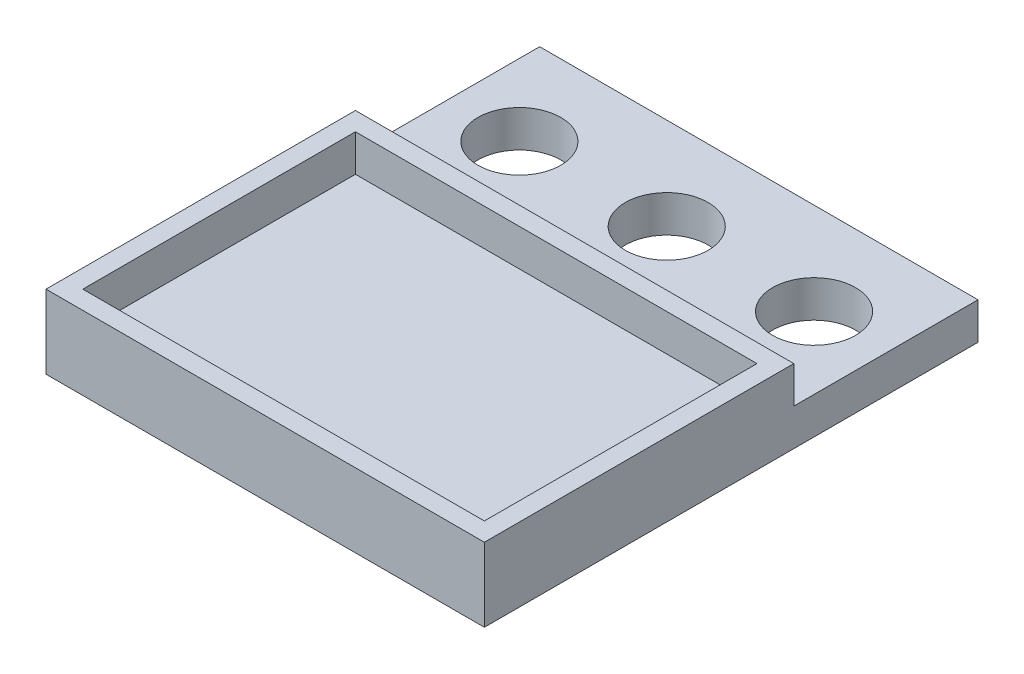
from build123d import *

# Parameters (mm, degrees)
SKETCH_1_W      = 23.8
SKETCH_1_H      = 10
SKETCH_1_R      = 2.25
SKETCH_1_H_2    = 16.8
SKETCH_1_W_2    = 21.8
SKETCH_1_H_3    = 14.8
EXTRUDE_1_DEPTH = 2
EXTRUDE_START   = 2
SKETCH_1_3_W    = 23.8
SKETCH_1_3_H    = 16.8
SKETCH_1_3_W_2  = 21.8
SKETCH_1_3_H_2  = 14.8
EXTRUDE_2_DEPTH = 2


with BuildPart() as part:
    # 草图1 → 凸台-拉伸1 (new body)
    # profile 1 of 3: a face of its own
    with BuildSketch(Plane(origin=(0, 0, 0), x_dir=(1, 0, 0), z_dir=(0, 1, 0))):
        with Locations((0, 13.4)):
            Rectangle(SKETCH_1_W, SKETCH_1_H)
        with Locations(Location((0, 13.4, 0), (0, 0, 270))):
            Circle(SKETCH_1_R, mode=Mode.SUBTRACT)
        with Locations(Location((-8, 13.4, 0), (0, 0, 270))):
            Circle(SKETCH_1_R, mode=Mode.SUBTRACT)
        with Locations(Location((8, 13.4, 0), (0, 0, 270))):
            Circle(SKETCH_1_R, mode=Mode.SUBTRACT)
    # profile 2 of 3: a face of its own
    with BuildSketch(Plane(origin=(0, 0, 0), x_dir=(1, 0, 0), z_dir=(0, 1, 0))):
        Rectangle(SKETCH_1_W, SKETCH_1_H_2)
        Rectangle(SKETCH_1_W_2, SKETCH_1_H_3, mode=Mode.SUBTRACT)
    # profile 3 of 3: a face of its own
    with BuildSketch(Plane(origin=(0, 0, 0), x_dir=(1, 0, 0), z_dir=(0, 1, 0))):
        Rectangle(SKETCH_1_W_2, SKETCH_1_H_3)
    extrude(amount=EXTRUDE_1_DEPTH)

    # 草图1<3> → 凸台-拉伸2 (add)
    with BuildSketch(Plane(origin=(0, 0, 0), x_dir=(1, 0, 0), z_dir=(0, 1, 0)).offset(EXTRUDE_START)):
        Rectangle(SKETCH_1_3_W, SKETCH_1_3_H)
        Rectangle(SKETCH_1_3_W_2, SKETCH_1_3_H_2, mode=Mode.SUBTRACT)
    extrude(amount=EXTRUDE_2_DEPTH)


solid = part.part
